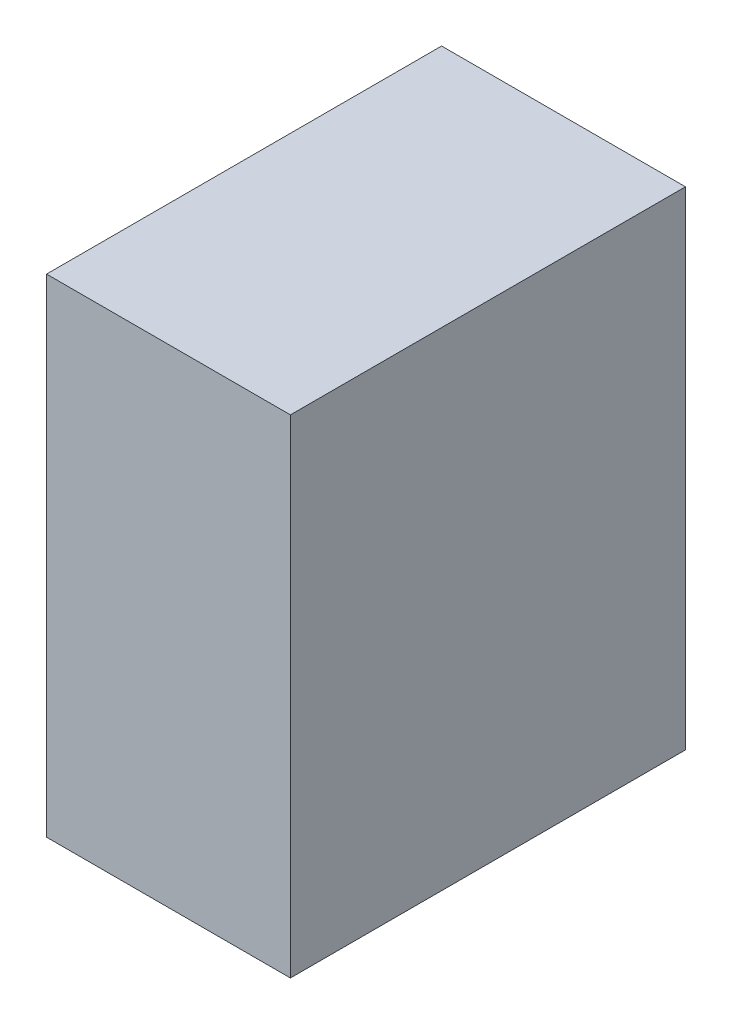
from build123d import *

# Parameters (mm, degrees)
SKETCH1_W           = 16.2
SKETCH1_H           = 20
BOSS_EXTRUDE1_DEPTH = 10


with BuildPart() as part:
    # Sketch1 → Boss-Extrude1 (new body)
    with BuildSketch(Plane(origin=(0, 0, 0), x_dir=(0, 0, -1), z_dir=(1, 0, 0))):
        with Locations((8.1, 10)):
            Rectangle(SKETCH1_W, SKETCH1_H)
    extrude(amount=-BOSS_EXTRUDE1_DEPTH)


solid = part.part
